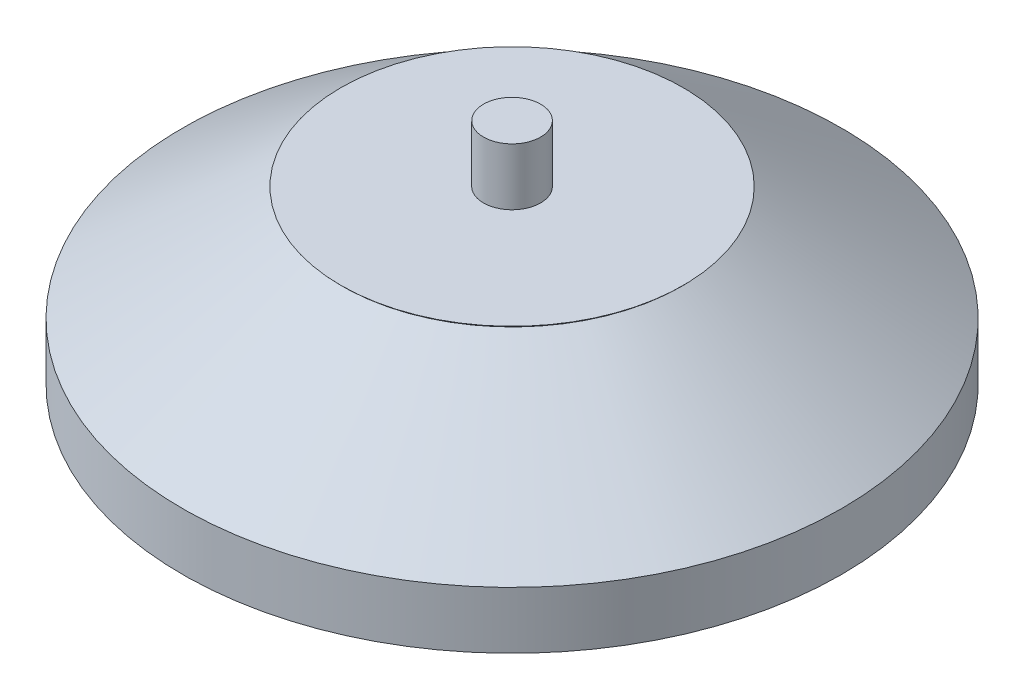
from build123d import *

# Parameters (mm, degrees)
SKETCH11_R          = 12
BOSS_EXTRUDE3_DEPTH = 2
SKETCH13_R          = 11.54797541
BOSS_EXTRUDE4_DEPTH = 2
SKETCH14_R          = 1
BOSS_EXTRUDE5_DEPTH = 2


with BuildPart() as part:
    # Sketch1 → Revolve1 (revolve)
    with BuildSketch(Plane.XY):
        Polygon((0.388993331, -0.067795133), (-5.226777212, -4), (6.321198199, -4), (6.321198199, 6), (-5.678801801, 6), align=None)
    revolve(axis=Axis((6.321198199, 11.047707555, 0), (0, -1, 0)))


with BuildPart() as body_2:
    # Split2: the piece on the far side of the plane
    add(part.part)
    split(bisect_by=Plane.ZX, keep=Keep.BOTTOM)

    # Sketch13 → Boss-Extrude4 (add)
    with BuildSketch(Plane.XZ.offset(4)):
        with Locations((6.321198199, 0)):
            Circle(SKETCH13_R)
    extrude(amount=BOSS_EXTRUDE4_DEPTH)

    # Sketch14 → Boss-Extrude5 (add)
    with BuildSketch(Plane(origin=(0, 0, 0), x_dir=(1, 0, 0), z_dir=(0, 1, 0))):
        with Locations(Location((6.321198199, 0, 0), (0, 0, 270))):
            Circle(SKETCH14_R)
    extrude(amount=BOSS_EXTRUDE5_DEPTH)


with BuildPart() as part_1:
    add(part.part)

    # Split2
    split(bisect_by=Plane.ZX, keep=Keep.TOP)

    # Sketch11 → Boss-Extrude3 (add)
    with BuildSketch(Plane(origin=(0, 6, 0), x_dir=(1, 0, 0), z_dir=(0, 1, 0))):
        with Locations(Location((6.321198199, 0, 0), (0, 0, 180))):
            Circle(SKETCH11_R)
    extrude(amount=BOSS_EXTRUDE3_DEPTH)


solid = body_2.part
